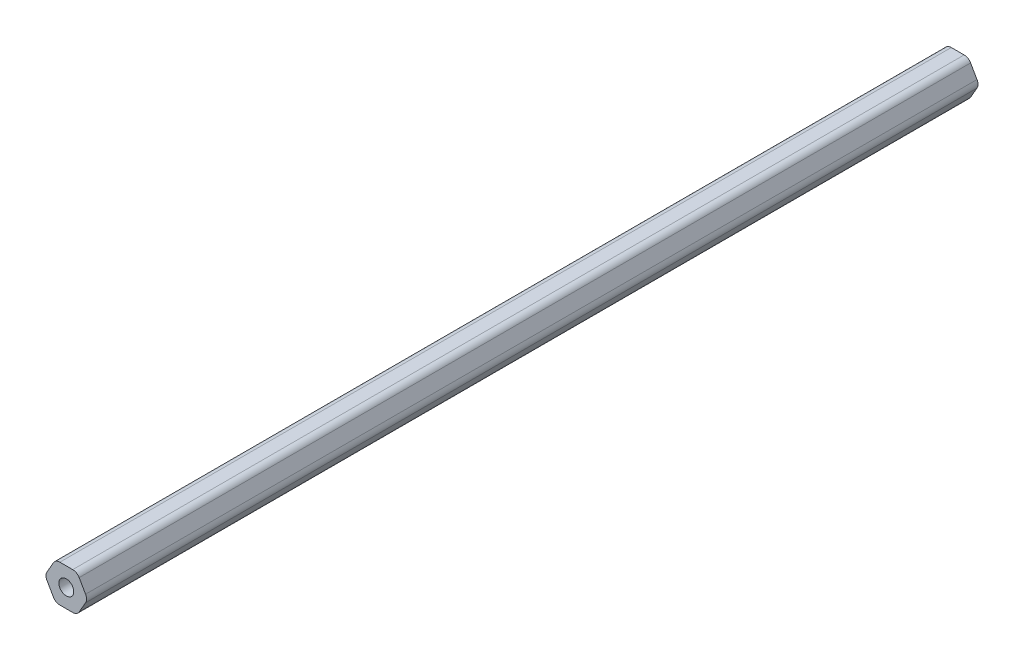
from build123d import *

# Parameters (mm, degrees)
SKETCH1_R           = 2.54
BOSS_EXTRUDE1_DEPTH = 304.8
FILLET1_R           = 2.54


with BuildPart() as part:
    # Sketch1 → Boss-Extrude1 (new body)
    with BuildSketch(Plane.XY):
        Polygon((0.982348419, -1.377830189), (-2.683825791, 4.972169811), (-10.016174209, 4.972169811), (-13.682348419, -1.377830189), (-10.016174209, -7.727830189), (-2.683825791, -7.727830189), align=None)
        with Locations(Location((-6.35, -1.377830189, 0), (0, 0, 180))):
            Circle(SKETCH1_R, mode=Mode.SUBTRACT)
    extrude(amount=BOSS_EXTRUDE1_DEPTH)

    # Fillet1
    fillet1_edges = [part.edges().sort_by_distance(p)[0] for p in [
        (-2.683825791, -7.727830189, 152.4),
        (-10.016174209, -7.727830189, 152.4),
        (-13.682348419, -1.377830189, 152.4),
        (-10.016174209, 4.972169811, 152.4),
        (-2.683825791, 4.972169811, 152.4),
        (0.982348419, -1.377830189, 152.4),
    ]]
    fillet(fillet1_edges, radius=FILLET1_R)


solid = part.part
